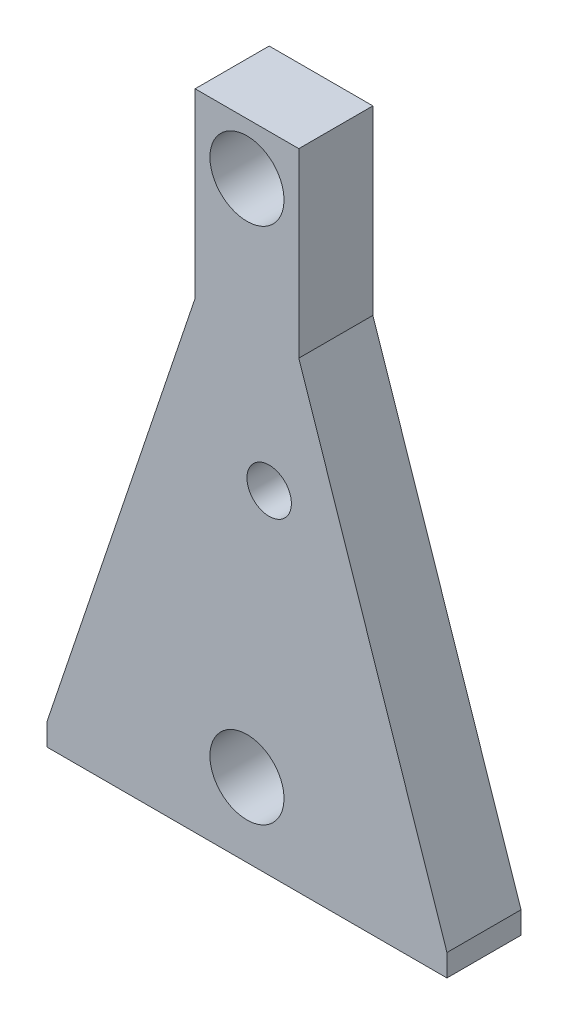
from build123d import *

# Parameters (mm, degrees)
ESQUISSE1_W             = 7
ESQUISSE1_H             = 42
BOSS_EXTRU_1_DEPTH      = 5
ESQUISSE2_R             = 2.5
ENL_V_MAT_EXTRU_1_DEPTH = 43.87190222
ESQUISSE3_R             = 1.5
ENL_V_MAT_EXTRU_2_DEPTH = 10
BOSS_EXTRU_2_DEPTH      = 5
ESQUISSE7_W             = 27
ESQUISSE7_H             = 5
BOSS_EXTRU_3_DEPTH      = 1.49
TROU_TARAUD_M32_D       = 2.5
TROU_TARAUD_M32_DEPTH   = 8.5
TROU_TARAUD_M32_TIP     = 0.751075774


with BuildPart() as part:
    # Esquisse1 → Boss.-Extru.1 (new body)
    with BuildSketch(Plane.XY):
        with Locations((3.5, 21)):
            Rectangle(ESQUISSE1_W, ESQUISSE1_H)
    extrude(amount=BOSS_EXTRU_1_DEPTH)

    # Esquisse2 → Enlèv. mat.-Extru.1 (cut, through all)
    with BuildSketch(Plane(origin=(0, 0, 0), x_dir=(-1, 0, 0), z_dir=(0, 0, -1))):
        with Locations((-3.5, 38.5)):
            Circle(ESQUISSE2_R)
        with Locations((-3.5, 3.5)):
            Circle(ESQUISSE2_R)
    extrude(amount=-ENL_V_MAT_EXTRU_1_DEPTH, mode=Mode.SUBTRACT)

    # Esquisse3 → Enlèv. mat.-Extru.2 (cut)
    with BuildSketch(Plane(origin=(0, 0, 0), x_dir=(-1, 0, 0), z_dir=(0, 0, -1))):
        with Locations((-5, 21)):
            Circle(ESQUISSE3_R)
    extrude(amount=-ENL_V_MAT_EXTRU_2_DEPTH, mode=Mode.SUBTRACT)

    # Esquisse4 → Boss.-Extru.2 (add)
    with BuildSketch(Plane(origin=(0, 0, 0), x_dir=(-1, 0, 0), z_dir=(0, 0, -1))):
        Polygon((-7, 29.75), (-17, 0), (-7, 0), align=None)
        Polygon((10, 0), (0, 0), (0, 29.75), align=None)
    extrude(amount=-BOSS_EXTRU_2_DEPTH)

    # Esquisse7 → Boss.-Extru.3 (add)
    with BuildSketch(Plane(origin=(0, 0, 0), x_dir=(-1, 0, 0), z_dir=(0, -1, 0))):
        with Locations((-3.5, -2.5)):
            Rectangle(ESQUISSE7_W, ESQUISSE7_H)
    extrude(amount=BOSS_EXTRU_3_DEPTH)

    # Trou taraudé M32
    with Locations(Plane(origin=(0, -1.49, 0), x_dir=(-1, 0, 0), z_dir=(0, -1, 0))):
        with Locations((4, -2.5), (-11, -2.5)):
            Hole(TROU_TARAUD_M32_D / 2, depth=TROU_TARAUD_M32_DEPTH)
            with Locations((0, 0, -(TROU_TARAUD_M32_DEPTH + TROU_TARAUD_M32_TIP / 2))):  # 118° drill point
                Cone(0, TROU_TARAUD_M32_D / 2, TROU_TARAUD_M32_TIP, mode=Mode.SUBTRACT)


solid = part.part
